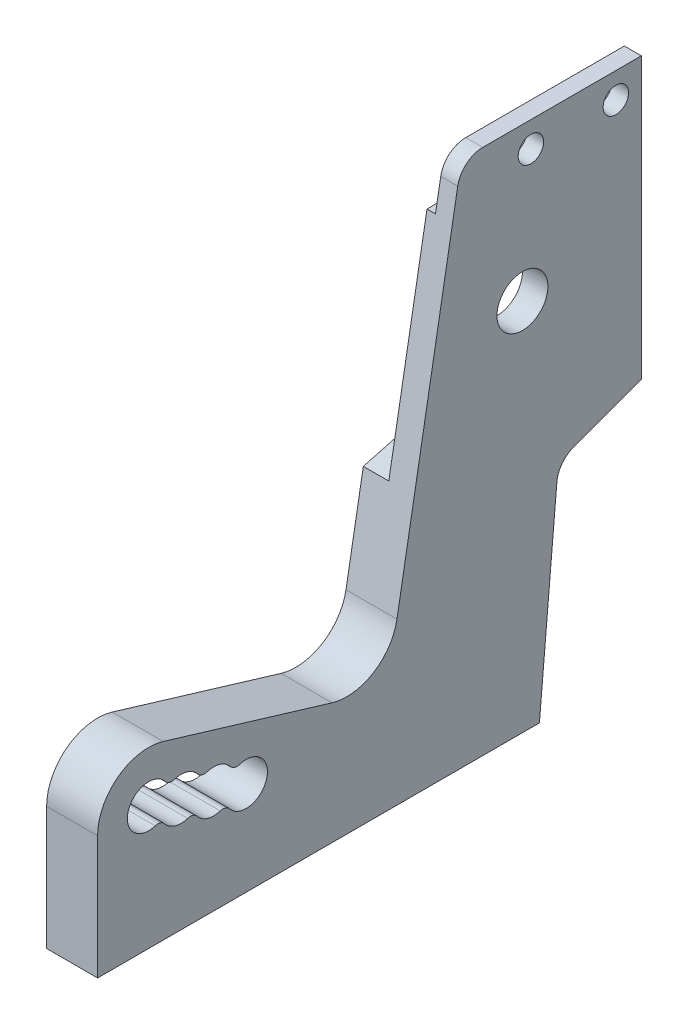
from build123d import *

# Parameters (mm, degrees)
SKETCH1_W                   = 64
SKETCH1_H                   = 62
SKETCH1_R                   = 2.5
SKETCH1_R_2                 = 3
BOSS_EXTRUDE1_DEPTH         = 6
CUT_EXTRUDE1_REACH          = 91.308
CUT_EXTRUDE2_REACH          = 91.308
FILLET1_R                   = 3
FILLET2_R                   = 3
TAP_DRILL_FOR_M3_TAP1_D     = 2.5
TAP_DRILL_FOR_M3_TAP1_DEPTH = 9
TAP_DRILL_FOR_M3_TAP1_TIP   = 0.751075774
CUT_EXTRUDE3_DEPTH          = 3
CUT_EXTRUDE4_REACH          = 91.157
SKETCH10_R                  = 1.5
CUT_EXTRUDE5_REACH          = 91.308
SKETCH11_R                  = 2.5
LPATTERN1_COUNT             = 3
LPATTERN1_PITCH             = 4
FILLET3_R                   = 1
SKETCH12_W                  = 22.982575198
SKETCH12_H                  = 6
CUT_EXTRUDE6_DEPTH          = 1


with BuildPart() as part:
    # Sketch1 → Boss-Extrude1 (new body)
    with BuildSketch(Plane(origin=(0, 0, 0), x_dir=(0, 0, -1), z_dir=(1, 0, 0))):
        with Locations((32, 31)):
            Rectangle(SKETCH1_W, SKETCH1_H)
        with Locations((6, 14.5)):
            Circle(SKETCH1_R, mode=Mode.SUBTRACT)
        with Locations((50, 44)):
            Circle(SKETCH1_R_2, mode=Mode.SUBTRACT)
    extrude(amount=BOSS_EXTRUDE1_DEPTH)

    # Sketch2 → Cut-Extrude1 (cut, up to next)
    with BuildSketch(Plane(origin=(6, 0, 0), x_dir=(0, 0, -1), z_dir=(1, 0, 0)), mode=Mode.PRIVATE) as cut_extrude1_sk1:
        with BuildLine():
            Line((7.732242893, 20.244504727), (27.593137265, 14.255495273))
            ThreePointArc((27.593137265, 14.255495273), (32.470162023, 14.890171527), (35.234226676, 18.958110934))
            Line((35.234226676, 18.958110934), (43, 63))
            Line((43, 63), (0, 63))
            Line((0, 63), (0, 14.5))
            ThreePointArc((0, 14.5), (2.421834084, 19.316298234), (7.732242893, 20.244504727))
        make_face()
    cut_extrude1_tool1 = extrude(cut_extrude1_sk1.sketch, amount=-CUT_EXTRUDE1_REACH, mode=Mode.PRIVATE) & part.part
    add(cut_extrude1_tool1.solids().sort_by_distance((6, 40.863189, -19.912877))[0], mode=Mode.SUBTRACT)

    # Sketch3 → Cut-Extrude2 (cut, up to next)
    with BuildSketch(Plane(origin=(6, 0, 0), x_dir=(0, 0, -1), z_dir=(1, 0, 0)), mode=Mode.PRIVATE) as cut_extrude2_sk1:
        Polygon((64, 0), (52, 0), (54.225932994, 25.442530542), (64, 29), align=None)
    cut_extrude2_tool1 = extrude(cut_extrude2_sk1.sketch, amount=-CUT_EXTRUDE2_REACH, mode=Mode.PRIVATE) & part.part
    add(cut_extrude2_tool1.solids().sort_by_distance((6, 13.1347, -58.667711))[0], mode=Mode.SUBTRACT)

    # Fillet1
    fillet1_edges = [part.edges().sort_by_distance(p)[0] for p in [
        (3, 62, -42.823673019),
    ]]
    fillet(fillet1_edges, radius=FILLET1_R)

    # Fillet2
    fillet2_edges = [part.edges().sort_by_distance(p)[0] for p in [
        (3, 25.442530542, -54.225932994),
    ]]
    fillet(fillet2_edges, radius=FILLET2_R)

    # Tap Drill for M3 Tap1
    with Locations(Plane(origin=(0, 0, 0), x_dir=(-1, 0, 0), z_dir=(0, -1, 0))):
        with Locations((-3, 48), (-3, 12)):
            Hole(TAP_DRILL_FOR_M3_TAP1_D / 2, depth=TAP_DRILL_FOR_M3_TAP1_DEPTH)
            with Locations((0, 0, -(TAP_DRILL_FOR_M3_TAP1_DEPTH + TAP_DRILL_FOR_M3_TAP1_TIP / 2))):  # 118° drill point
                Cone(0, TAP_DRILL_FOR_M3_TAP1_D / 2, TAP_DRILL_FOR_M3_TAP1_TIP, mode=Mode.SUBTRACT)

    # Sketch9 → Cut-Extrude3 (cut)
    with BuildSketch(Plane.ZY):
        Polygon((-64, 62), (-64, 35), (-54, 35), (-37.272527114, 30.517887149), (-42.823673019, 62), align=None)
    extrude(amount=-CUT_EXTRUDE3_DEPTH, mode=Mode.SUBTRACT)

    # Sketch10 → Cut-Extrude4 (cut, up to next)
    with BuildSketch(Plane.ZY.offset(-3), mode=Mode.PRIVATE) as cut_extrude4_sk1:
        with Locations((-61, 59)):
            Circle(SKETCH10_R)
    cut_extrude4_tool1 = extrude(cut_extrude4_sk1.sketch, amount=-CUT_EXTRUDE4_REACH, mode=Mode.PRIVATE) & part.part
    # Sketch10 → Cut-Extrude4 (cut, up to next)
    with BuildSketch(Plane.ZY.offset(-3), mode=Mode.PRIVATE) as cut_extrude4_sk2:
        with Locations((-51, 59)):
            Circle(SKETCH10_R)
    cut_extrude4_tool2 = extrude(cut_extrude4_sk2.sketch, amount=-CUT_EXTRUDE4_REACH, mode=Mode.PRIVATE) & part.part
    add(cut_extrude4_tool1.solids().sort_by_distance((3, 59, -61))[0], mode=Mode.SUBTRACT)
    add(cut_extrude4_tool2.solids().sort_by_distance((3, 59, -51))[0], mode=Mode.SUBTRACT)

    # Sketch11 → Cut-Extrude5 (cut, up to next)
    with BuildSketch(Plane.ZY, mode=Mode.PRIVATE) as cut_extrude5_sk1:
        with Locations((-9.829669818, 13.345171405)):
            Circle(SKETCH11_R)
    cut_extrude5_tool1 = extrude(cut_extrude5_sk1.sketch, amount=-CUT_EXTRUDE5_REACH, mode=Mode.PRIVATE) & part.part
    cut_extrude5 = cut_extrude5_tool1.solids().sort_by_distance((0, 13.345171, -9.82967))[0]
    add(cut_extrude5, mode=Mode.SUBTRACT)

    # LPattern1: Cut-Extrude5 ×3
    with Locations(*[Vector(0, -0.28870714879763304, -0.9574174545270947) * (i * LPATTERN1_PITCH) for i in range(1, LPATTERN1_COUNT)]):
        add(cut_extrude5, mode=Mode.SUBTRACT)

    # Fillet3
    fillet3_edges = [part.edges().sort_by_distance(p)[0] for p in [
        (3, 15.358711884, -8.347895632),
        (3, 12.486459521, -7.481774186),
        (3, 14.203883289, -12.17756545),
        (3, 11.331630925, -11.311444004),
        (3, 10.17680233, -15.141113822),
        (3, 13.049054694, -16.007235268),
    ]]
    fillet(fillet3_edges, radius=FILLET3_R)

    # Sketch12 → Cut-Extrude6 (cut)
    with BuildSketch(Plane.ZY.offset(-3)):
        with Locations((-52.508712401, 59)):
            Rectangle(SKETCH12_W, SKETCH12_H)
    extrude(amount=-CUT_EXTRUDE6_DEPTH, mode=Mode.SUBTRACT)


solid = part.part
